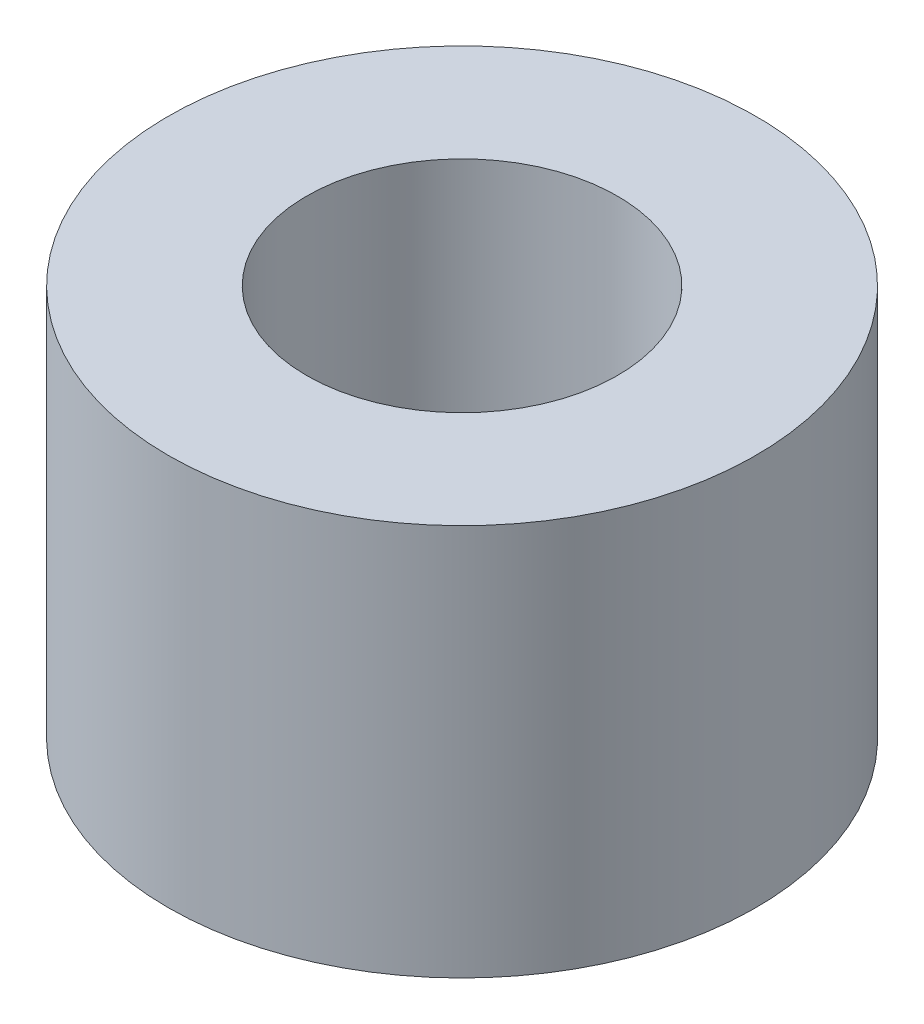
from build123d import *

# Parameters (mm, degrees)
SKETCH1_R           = 9
SKETCH1_R_2         = 4.7625
BOSS_EXTRUDE1_DEPTH = 12


with BuildPart() as part:
    # Sketch1 → Boss-Extrude1 (new body)
    with BuildSketch(Plane(origin=(0, 0, 0), x_dir=(1, 0, 0), z_dir=(0, 1, 0))):
        with Locations(Location((0, 0, 0), (0, 0, 270))):
            Circle(SKETCH1_R)
        with Locations(Location((0, 0, 0), (0, 0, 270))):
            Circle(SKETCH1_R_2, mode=Mode.SUBTRACT)
    extrude(amount=BOSS_EXTRUDE1_DEPTH)


solid = part.part
